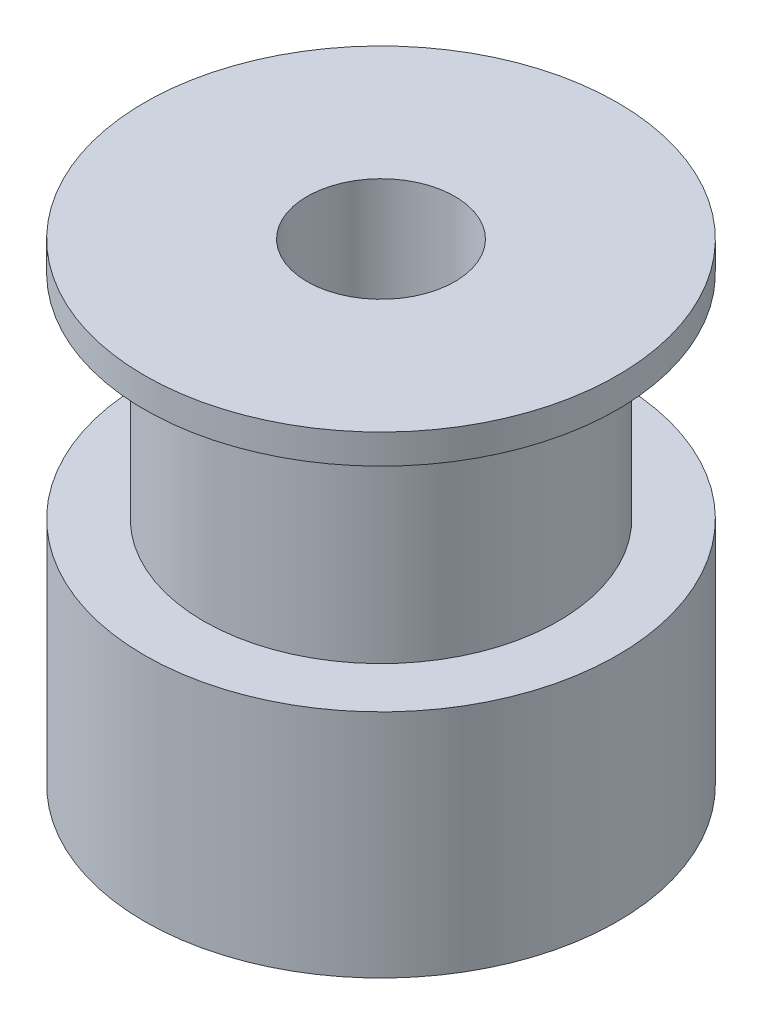
from build123d import *

# Parameters (mm, degrees)
SKETCH_2_R          = 8
EXTRUDE_1_DEPTH     = 16
SKETCH_3_W          = 2.435323
SKETCH_3_H          = 7.2
SKETCH_4_R          = 2.5
CUT_EXTRUDE_1_DEPTH = 16


with BuildPart() as part:
    # 스케치2 → 보스-돌출1 (new body)
    with BuildSketch(Plane(origin=(0, 0, 0), x_dir=(1, 0, 0), z_dir=(0, 1, 0))):
        with Locations(Location((0, 0, 0), (0, 0, 270))):
            Circle(SKETCH_2_R)
    extrude(amount=EXTRUDE_1_DEPTH)

    # 스케치3 → 컷-회전1 (revolve, cut)
    with BuildSketch(Plane.XY, mode=Mode.PRIVATE) as cut_revolve_1_sk:
        with Locations((7.2176615, 11.4)):
            Rectangle(SKETCH_3_W, SKETCH_3_H)
    revolve(cut_revolve_1_sk.sketch.rotate(Axis((0, 16, 0), (0, -1, 0)), 90), axis=Axis((0, 16, 0), (0, -1, 0)), mode=Mode.SUBTRACT)

    # 스케치4 → 컷-돌출1 (cut)
    with BuildSketch(Plane(origin=(0, 16, 0), x_dir=(1, 0, 0), z_dir=(0, 1, 0))):
        with Locations(Location((0, 0, 0), (0, 0, 270))):
            Circle(SKETCH_4_R)
    extrude(amount=-CUT_EXTRUDE_1_DEPTH, mode=Mode.SUBTRACT)


solid = part.part
